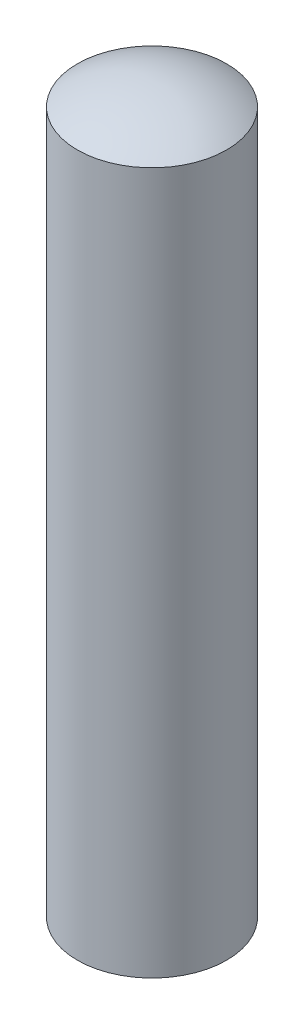
from build123d import *


with BuildPart() as part:
    # Sketch1 → Revolve1 (revolve)
    with BuildSketch(Plane.XY):
        with BuildLine():
            Line((4, -1.2), (4, -38.8))
            ThreePointArc((4, -38.8), (2.088061302, -39.693537673), (0, -40))
            Line((0, -40), (0, 0))
            ThreePointArc((0, 0), (2.088061302, -0.306462327), (4, -1.2))
        make_face()
    revolve(axis=Axis((0, 5, 0), (0, -1, 0)))


solid = part.part
